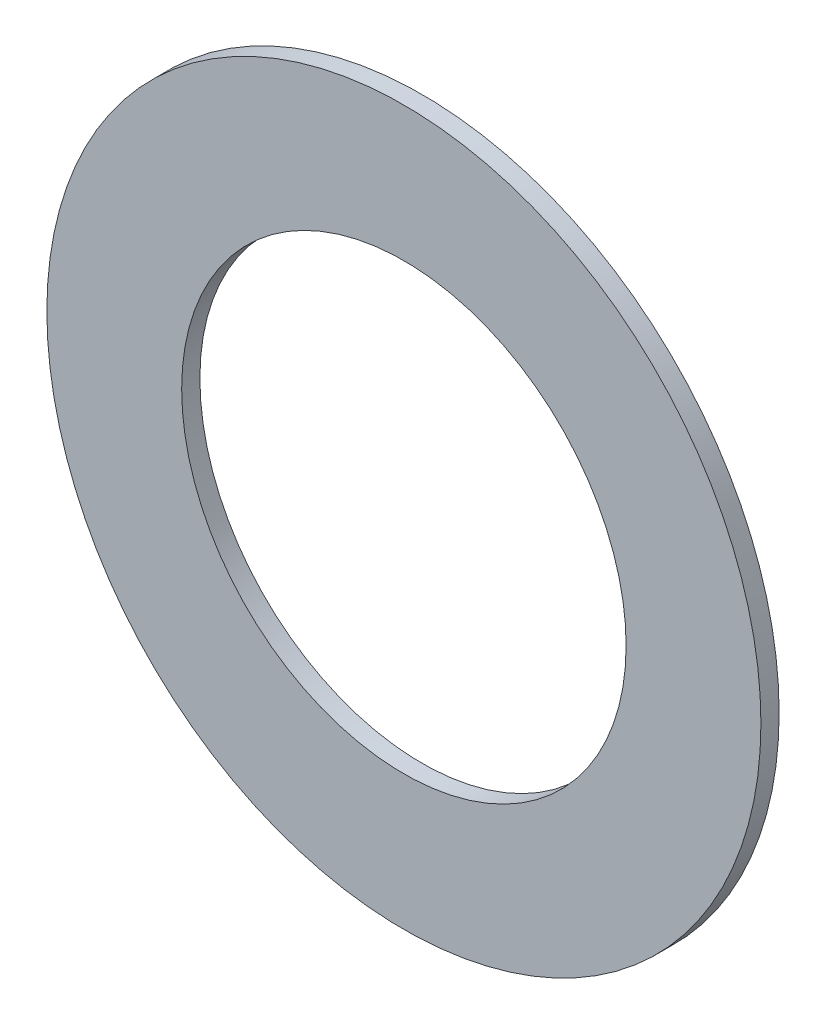
from build123d import *

# Parameters (mm, degrees)
ESQUISSE1_R      = 9.8
ESQUISSE1_R_2    = 6.1
EXTRUSION1_DEPTH = 0.5


with BuildPart() as part:
    # Esquisse1 → Extrusion1 (new body)
    with BuildSketch(Plane.XY):
        Circle(ESQUISSE1_R)
        Circle(ESQUISSE1_R_2, mode=Mode.SUBTRACT)
    extrude(amount=EXTRUSION1_DEPTH)


solid = part.part
